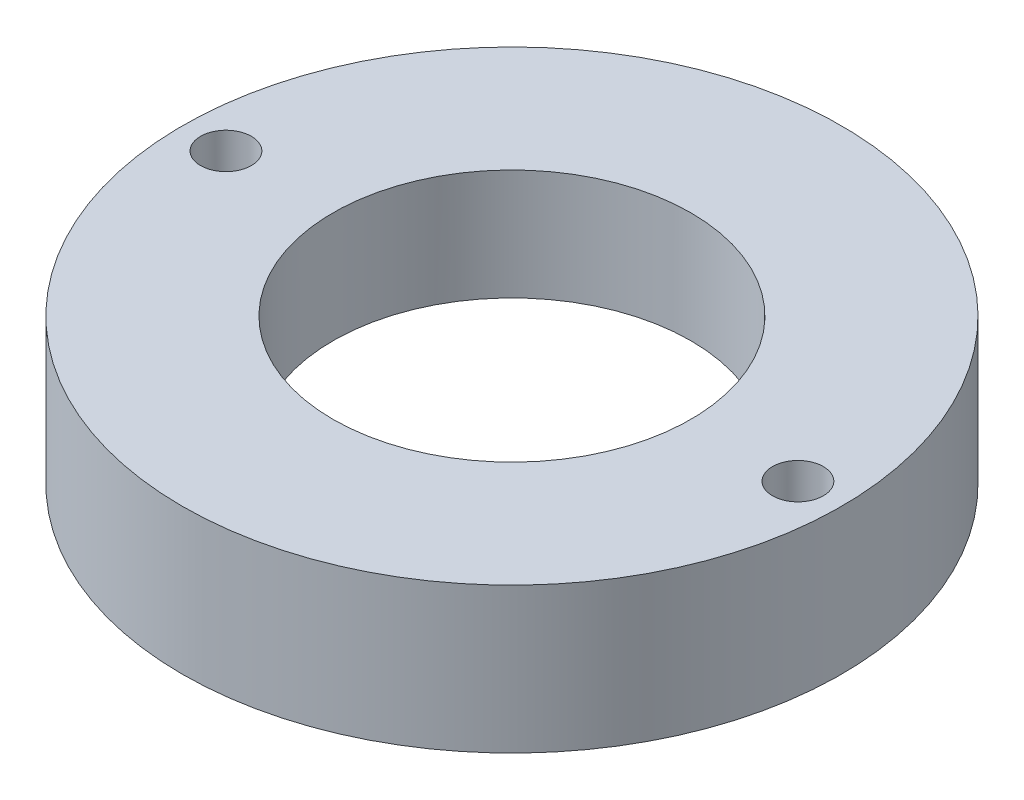
from build123d import *

# Parameters (mm, degrees)
SKETCH2_R           = 28.55
BOSS_EXTRUDE1_DEPTH = 12.6
SKETCH3_R           = 21
CUT_EXTRUDE1_DEPTH  = 3
SKETCH4_R           = 15.5
CUT_EXTRUDE2_DEPTH  = 24
SKETCH5_R           = 2.2
CUT_EXTRUDE3_DEPTH  = 24


with BuildPart() as part:
    # Sketch2 → Boss-Extrude1 (new body)
    with BuildSketch(Plane(origin=(0, 0, 0), x_dir=(1, 0, 0), z_dir=(0, 1, 0))):
        with Locations(Location((0, 0, 0), (0, 0, 270))):
            Circle(SKETCH2_R)
    extrude(amount=BOSS_EXTRUDE1_DEPTH)

    # Sketch3 → Cut-Extrude1 (cut)
    with BuildSketch(Plane.XZ):
        with Locations(Location((0, 0, 0), (0, 0, 270))):
            Circle(SKETCH3_R)
    extrude(amount=-CUT_EXTRUDE1_DEPTH, mode=Mode.SUBTRACT)

    # Sketch4 → Cut-Extrude2 (cut)
    with BuildSketch(Plane.XZ.offset(-3)):
        with Locations(Location((0, 0, 0), (0, 0, 270))):
            Circle(SKETCH4_R)
    extrude(amount=-CUT_EXTRUDE2_DEPTH, mode=Mode.SUBTRACT)

    # Sketch5 → Cut-Extrude3 (cut)
    with BuildSketch(Plane(origin=(0, 0, 0), x_dir=(-1, 0, 0), z_dir=(0, -1, 0))):
        with Locations(Location((-24.775, 0, 0), (0, 0, 90))):
            Circle(SKETCH5_R)
    cut_extrude3 = extrude(amount=-CUT_EXTRUDE3_DEPTH, mode=Mode.SUBTRACT)

    # Mirror1: Cut-Extrude3 across plane
    add(cut_extrude3.mirror(Plane(origin=(0, 0, 0), x_dir=(0, 0, 1), z_dir=(1, 0, 0))), mode=Mode.SUBTRACT)


solid = part.part
